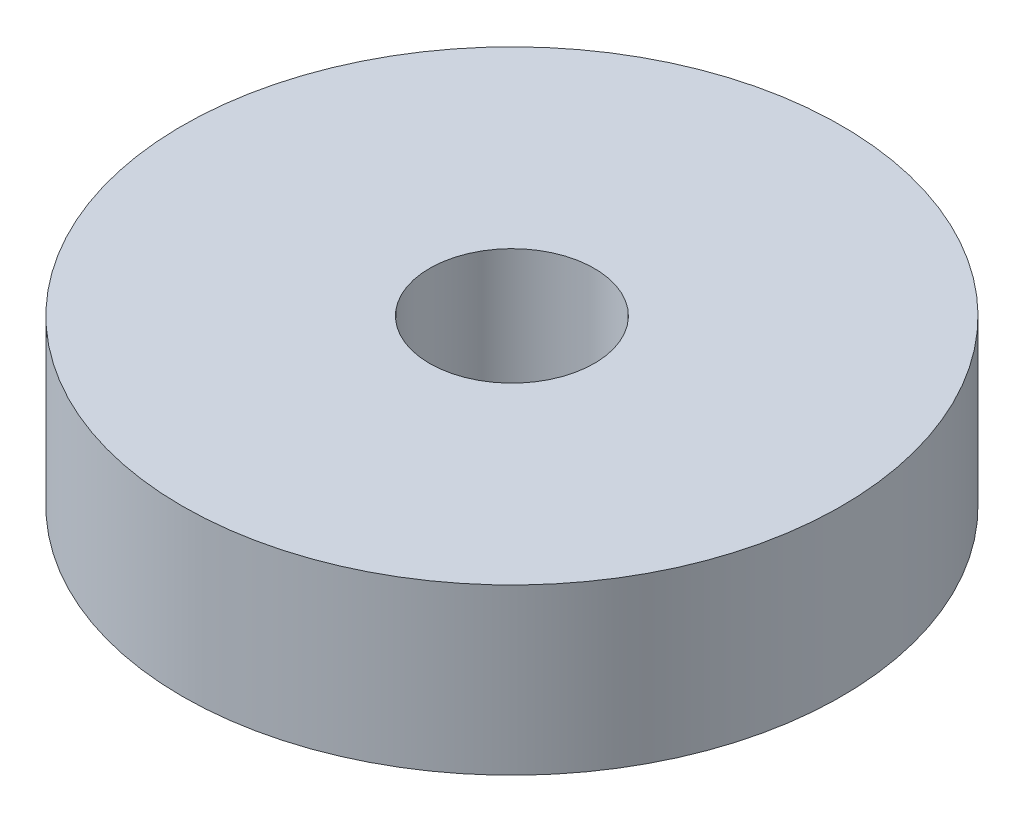
from build123d import *

# Parameters (mm, degrees)
SKETCH1_R           = 30
SKETCH1_R_2         = 7.5
BOSS_EXTRUDE1_DEPTH = 7.5


with BuildPart() as part:
    # Sketch1 → Boss-Extrude1 (new, symmetric)
    with BuildSketch(Plane(origin=(0, 0, 0), x_dir=(1, 0, 0), z_dir=(0, 1, 0))):
        with Locations(Location((0, 0, 0), (0, 0, 270))):
            Circle(SKETCH1_R)
        with Locations(Location((0, 0, 0), (0, 0, 270))):
            Circle(SKETCH1_R_2, mode=Mode.SUBTRACT)
    extrude(amount=BOSS_EXTRUDE1_DEPTH, both=True)


solid = part.part
